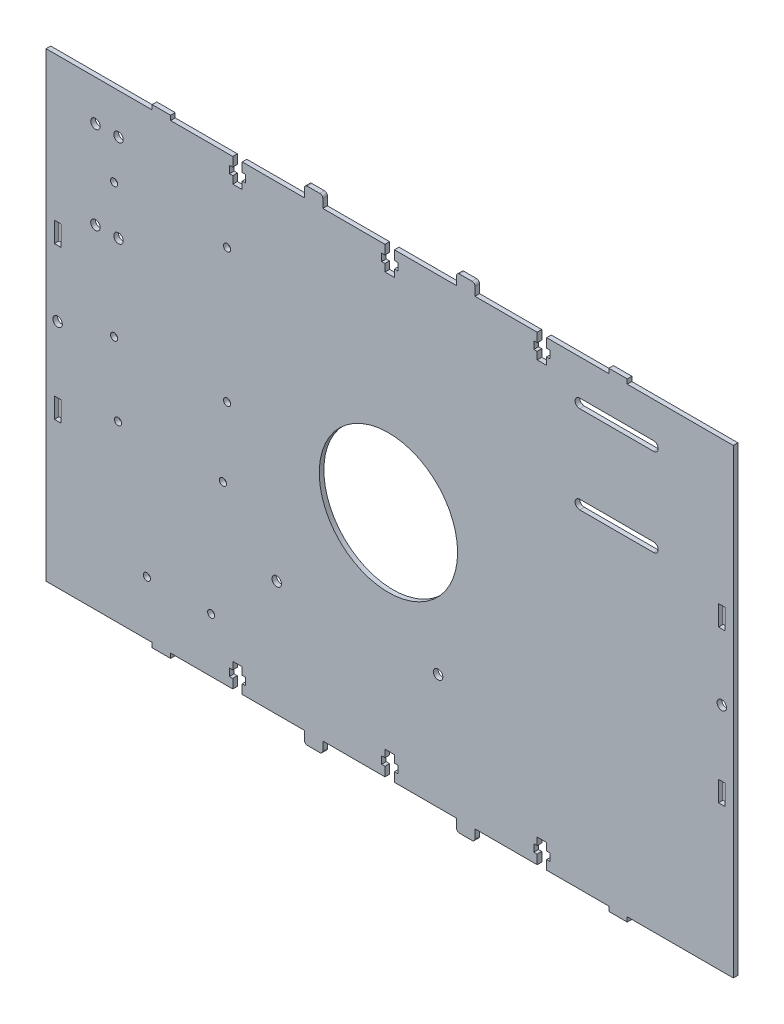
from build123d import *

# Parameters (mm, degrees)
SKETCH_1_R          = 2.05
SKETCH_1_R_2        = 30
SKETCH_1_W          = 2.8
SKETCH_1_H          = 8.8
EXTRUDE_1_DEPTH     = 2
SKETCH_4_W          = 8
SKETCH_4_H          = 3
SKETCH_4_R          = 1.55
SKETCH_4_R_2        = 2.05
CUT_EXTRUDE_1_DEPTH = 10
FILLET_1_R          = 1.3


with BuildPart() as part:
    # 草图1 → 凸台-拉伸1 (new body)
    with BuildSketch(Plane.XY):
        Polygon((0, 0), (0, -4), (-1.45, -4), (-1.45, -7.2), (0, -7.2), (0, -10.4), (4.1, -10.4), (4.1, -7.2), (5.55, -7.2), (5.55, -4), (4.1, -4), (4.1, 0), (31.05, 0), (31.05, 5), (39.05, 5), (39.05, 0), (66, 0), (66, -4), (64.55, -4), (64.55, -7.2), (66, -7.2), (66, -10.4), (70.1, -10.4), (70.1, -7.2), (71.55, -7.2), (71.55, -4), (70.1, -4), (70.1, 0), (97.05, 0), (97.05, 5), (105.05, 5), (105.05, 0), (132, 0), (144.05, 0), (146.05, 0), (151.05, 0), (151.05, -200), (146.05, -200), (144.05, -200), (132, -200), (105.05, -200), (105.05, -205), (97.05, -205), (97.05, -200), (70.1, -200), (70.1, -196), (71.55, -196), (71.55, -192.8), (70.1, -192.8), (70.1, -189.6), (66, -189.6), (66, -192.8), (64.55, -192.8), (64.55, -196), (66, -196), (66, -200), (39.05, -200), (39.05, -205), (31.05, -205), (31.05, -200), (4.1, -200), (4.1, -196), (5.55, -196), (5.55, -192.8), (4.1, -192.8), (4.1, -189.6), (0, -189.6), (0, -192.8), (-1.45, -192.8), (-1.45, -196), (0, -196), (0, -200), (-26.95, -200), (-26.95, -205), (-34.95, -205), (-34.95, -200), (-61.9, -200), (-61.9, -196), (-60.45, -196), (-60.45, -192.8), (-61.9, -192.8), (-61.9, -189.6), (-66, -189.6), (-66, -192.8), (-67.45, -192.8), (-67.45, -196), (-66, -196), (-66, -200), (-92.95, -200), (-92.95, -205), (-100.95, -205), (-100.95, -200), (-127.9, -200), (-139.95, -200), (-141.95, -200), (-146.95, -200), (-146.95, 0), (-141.95, 0), (-139.95, 0), (-127.9, 0), (-100.95, 0), (-100.95, 5), (-92.95, 5), (-92.95, 0), (-66, 0), (-66, -4), (-67.45, -4), (-67.45, -7.2), (-66, -7.2), (-66, -10.4), (-61.9, -10.4), (-61.9, -7.2), (-60.45, -7.2), (-60.45, -4), (-61.9, -4), (-61.9, 0), (-34.95, 0), (-34.95, 5), (-26.95, 5), (-26.95, 0), align=None)
        with Locations((-141.95, -100)):
            Circle(SKETCH_1_R, mode=Mode.SUBTRACT)
        with Locations(Location((146.05, -100, 0), (0, 0, 180))):
            Circle(SKETCH_1_R, mode=Mode.SUBTRACT)
        with Locations((1.5, -100)):
            Circle(SKETCH_1_R_2, mode=Mode.SUBTRACT)
        with Locations((-141.95, -67)):
            Rectangle(SKETCH_1_W, SKETCH_1_H, mode=Mode.SUBTRACT)
        with Locations((-141.95, -133)):
            Rectangle(SKETCH_1_W, SKETCH_1_H, mode=Mode.SUBTRACT)
        with Locations((146.05, -133)):
            Rectangle(SKETCH_1_W, SKETCH_1_H, mode=Mode.SUBTRACT)
        with Locations((146.05, -67)):
            Rectangle(SKETCH_1_W, SKETCH_1_H, mode=Mode.SUBTRACT)
    extrude(amount=EXTRUDE_1_DEPTH)

    # 草图4 → 切除-拉伸1 (cut)
    with BuildSketch(Plane.XY.offset(2)):
        with BuildLine():
            Line((116.459883662, -15.5), (84.45, -15.5))
            ThreePointArc((84.45, -15.5), (82.45, -17.5), (84.45, -19.5))
            Line((84.45, -19.5), (116.459883662, -19.5))
            ThreePointArc((116.459883662, -19.5), (118.459883662, -17.5), (116.459883662, -15.5))
        make_face()
        with BuildLine():
            ThreePointArc((84.45, -53.5), (82.45, -55.5), (84.45, -57.5))
            Line((84.45, -57.5), (116.459883662, -57.5))
            ThreePointArc((116.459883662, -57.5), (118.459883662, -55.5), (116.459883662, -53.5))
            Line((116.459883662, -53.5), (84.45, -53.5))
        make_face()
        with Locations((-96.95, 3.5)):
            Rectangle(SKETCH_4_W, SKETCH_4_H)
        with Locations((-96.95, -203.5)):
            Rectangle(SKETCH_4_W, SKETCH_4_H)
        with Locations((101.05, 3.5)):
            Rectangle(SKETCH_4_W, SKETCH_4_H)
        with Locations((101.05, -203.5)):
            Rectangle(SKETCH_4_W, SKETCH_4_H)
        with Locations((-75.364854909, -176.46991287)):
            Circle(SKETCH_4_R)
        with Locations((-103.264854909, -176.46991287)):
            Circle(SKETCH_4_R)
        with Locations((-70.264854909, -124.36991287)):
            Circle(SKETCH_4_R)
        with Locations((-115.764854909, -124.36991287)):
            Circle(SKETCH_4_R)
        with Locations((-117.464854909, -35.441983185)):
            Circle(SKETCH_4_R)
        with Locations((-68.464854909, -35.441983185)):
            Circle(SKETCH_4_R)
        with Locations((-117.464854909, -93.441983185)):
            Circle(SKETCH_4_R)
        with Locations((-68.464854909, -93.441983185)):
            Circle(SKETCH_4_R)
        with Locations((-125.55, -17.5)):
            Circle(SKETCH_4_R_2)
        with Locations((-125.55, -55.5)):
            Circle(SKETCH_4_R_2)
        with Locations((-115.55, -55.5)):
            Circle(SKETCH_4_R_2)
        with Locations(Location((-115.55, -17.5, 0), (0, 0, 180))):
            Circle(SKETCH_4_R_2)
        with Locations((-46.95, -150)):
            Circle(SKETCH_4_R_2)
        with Locations((23.05, -150)):
            Circle(SKETCH_4_R_2)
    extrude(amount=-CUT_EXTRUDE_1_DEPTH, mode=Mode.SUBTRACT)

    # 圆角1
    fillet_1_edges = [part.edges().sort_by_distance(p)[0] for p in [
        (31.05, 5, 1),
        (39.05, 5, 1),
        (39.05, -205, 1),
        (31.05, -205, 1),
        (-26.95, -205, 1),
        (-34.95, -205, 1),
        (-34.95, 5, 1),
        (-26.95, 5, 1),
    ]]
    fillet(fillet_1_edges, radius=FILLET_1_R)


solid = part.part
